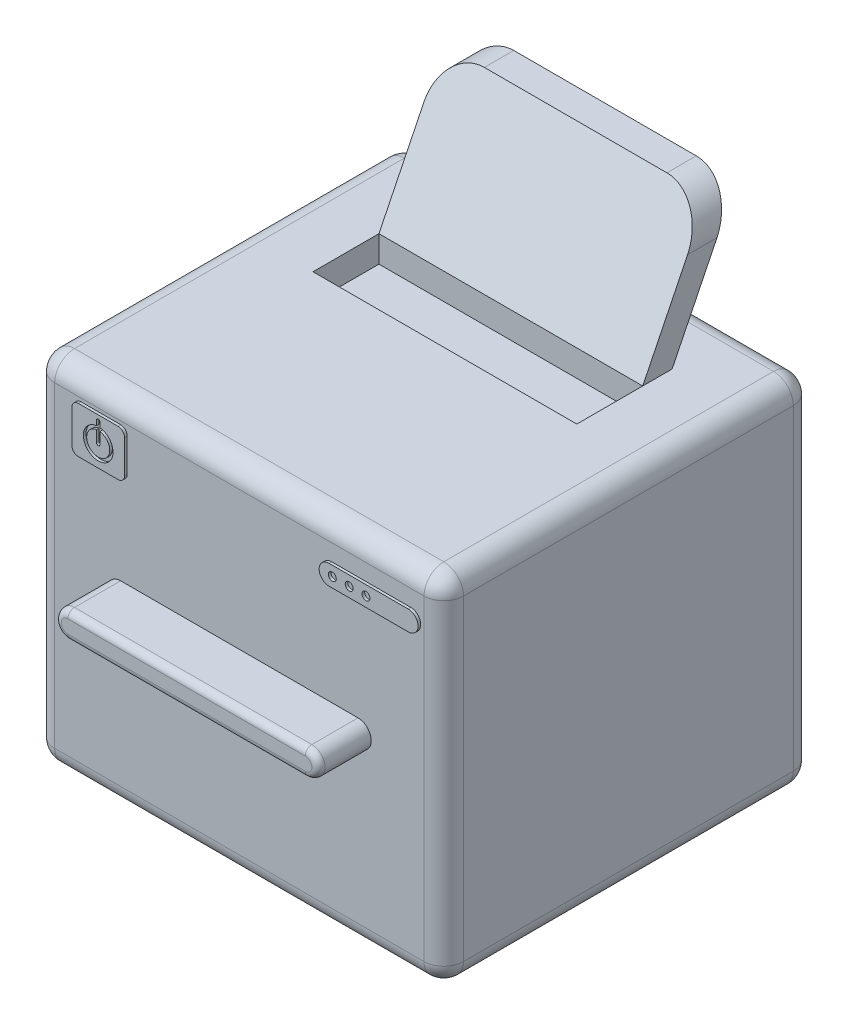
from build123d import *

# Parameters (mm, degrees)
SKETCH1_W           = 393.7
SKETCH1_H           = 342.9
BOSS_EXTRUDE1_DEPTH = 355.6
SKETCH2_W           = 50.8
SKETCH2_H           = 44.45
BOSS_EXTRUDE2_DEPTH = 2.54
BOSS_EXTRUDE3_DEPTH = 2.54
SKETCH4_R           = 3.81
CUT_EXTRUDE1_DEPTH  = 2.54
BOSS_EXTRUDE4_DEPTH = 50.8
FILLET1_R           = 6.35
FILLET2_R           = 6.35
SKETCH6_R           = 14.2875
SKETCH6_R_2         = 11.1125
CUT_EXTRUDE2_DEPTH  = 2.54
FILLET3_R           = 19.05
BOSS_EXTRUDE5_DEPTH = 127
FILLET4_R           = 39.116
SKETCH8_W           = 254
SKETCH8_H           = 63.5
CUT_EXTRUDE3_DEPTH  = 25.4


with BuildPart() as part:
    # Sketch1 → Boss-Extrude1 (new body)
    with BuildSketch(Plane.XY):
        with Locations((0, 171.45)):
            Rectangle(SKETCH1_W, SKETCH1_H)
    extrude(amount=BOSS_EXTRUDE1_DEPTH)

    # Sketch2 → Boss-Extrude2 (add)
    with BuildSketch(Plane.XY.offset(355.6)):
        with Locations((-133.35, 298.45)):
            Rectangle(SKETCH2_W, SKETCH2_H)
    extrude(amount=BOSS_EXTRUDE2_DEPTH)

    # Sketch3 → Boss-Extrude3 (add)
    with BuildSketch(Plane.XY.offset(355.6)):
        with BuildLine():
            Line((88.9, 307.975), (165.1, 307.975))
            ThreePointArc((165.1, 307.975), (174.625, 298.45), (165.1, 288.925))
            Line((165.1, 288.925), (88.9, 288.925))
            ThreePointArc((88.9, 288.925), (79.375, 298.45), (88.9, 307.975))
        make_face()
    extrude(amount=BOSS_EXTRUDE3_DEPTH)

    # Sketch4 → Cut-Extrude1 (cut)
    with BuildSketch(Plane.XY.offset(358.14)):
        with Locations((92.075, 298.45)):
            Circle(SKETCH4_R)
        with Locations((108.286467636, 298.45)):
            Circle(SKETCH4_R)
        with Locations((124.497935272, 298.45)):
            Circle(SKETCH4_R)
    extrude(amount=-CUT_EXTRUDE1_DEPTH, mode=Mode.SUBTRACT)

    # Sketch5 → Boss-Extrude4 (add)
    with BuildSketch(Plane.XY.offset(355.6)):
        with BuildLine():
            Line((-114.3, 190.5), (114.3, 190.5))
            ThreePointArc((114.3, 190.5), (127, 177.8), (114.3, 165.1))
            Line((114.3, 165.1), (-114.3, 165.1))
            ThreePointArc((-114.3, 165.1), (-127, 177.8), (-114.3, 190.5))
        make_face()
    extrude(amount=BOSS_EXTRUDE4_DEPTH)

    # Fillet1
    fillet1_edges = [part.edges().sort_by_distance(p)[0] for p in [
        (-127, 177.8, 406.4),
        (0, 165.1, 406.4),
        (127, 177.8, 406.4),
        (0, 190.5, 406.4),
    ]]
    fillet(fillet1_edges, radius=FILLET1_R)

    # Fillet2
    fillet2_edges = [part.edges().sort_by_distance(p)[0] for p in [
        (-107.95, 276.225, 356.87),
        (-107.95, 320.675, 356.87),
        (-158.75, 320.675, 356.87),
        (-158.75, 276.225, 356.87),
    ]]
    fillet(fillet2_edges, radius=FILLET2_R)

    # Sketch6 → Cut-Extrude2 (cut)
    # profile 1 of 2: a face of its own
    with BuildSketch(Plane.XY.offset(358.14)):
        with Locations((-133.35, 296.545)):
            Circle(SKETCH6_R)
        with Locations((-133.35, 296.545)):
            Circle(SKETCH6_R_2, mode=Mode.SUBTRACT)
    # profile 2 of 2: a face of its own
    with BuildSketch(Plane.XY.offset(358.14)):
        with BuildLine():
            Line((-134.9375, 296.545), (-134.9375, 315.595))
            ThreePointArc((-134.9375, 315.595), (-133.35, 317.1825), (-131.7625, 315.595))
            Line((-131.7625, 315.595), (-131.7625, 296.545))
            ThreePointArc((-131.7625, 296.545), (-133.35, 294.9575), (-134.9375, 296.545))
        make_face()
    extrude(amount=-CUT_EXTRUDE2_DEPTH, mode=Mode.SUBTRACT)

    # Fillet3
    fillet3_edges = [part.edges().sort_by_distance(p)[0] for p in [
        (196.85, 171.45, 355.6),
        (0, 342.9, 355.6),
        (-196.85, 171.45, 355.6),
        (0, 342.9, 0),
        (196.85, 171.45, 0),
        (0, 0, 0),
        (-196.85, 171.45, 0),
        (0, 0, 355.6),
        (-196.85, 342.9, 177.8),
        (196.85, 342.9, 177.8),
        (196.85, 0, 177.8),
        (-196.85, 0, 177.8),
    ]]
    fillet(fillet3_edges, radius=FILLET3_R)

    # Sketch7 → Boss-Extrude5 (add, symmetric)
    with BuildSketch(Plane(origin=(0, 0, 0), x_dir=(0, 0, -1), z_dir=(1, 0, 0))):
        Polygon((-65.877338054, 342.9), (-3.487013452, 469.9), (-31.786520589, 469.9), (-94.17684519, 342.9), align=None)
    extrude(amount=BOSS_EXTRUDE5_DEPTH, both=True)

    # Fillet4
    fillet4_edges = [part.edges().sort_by_distance(p)[0] for p in [
        (-127, 469.9, 17.636767021),
        (127, 469.9, 17.636767021),
    ]]
    fillet(fillet4_edges, radius=FILLET4_R)

    # Sketch8 → Cut-Extrude3 (cut)
    with BuildSketch(Plane(origin=(0, 342.9, 0), x_dir=(1, 0, 0), z_dir=(0, 1, 0))):
        with Locations((0, -125.92684519)):
            Rectangle(SKETCH8_W, SKETCH8_H)
    extrude(amount=-CUT_EXTRUDE3_DEPTH, mode=Mode.SUBTRACT)


solid = part.part
